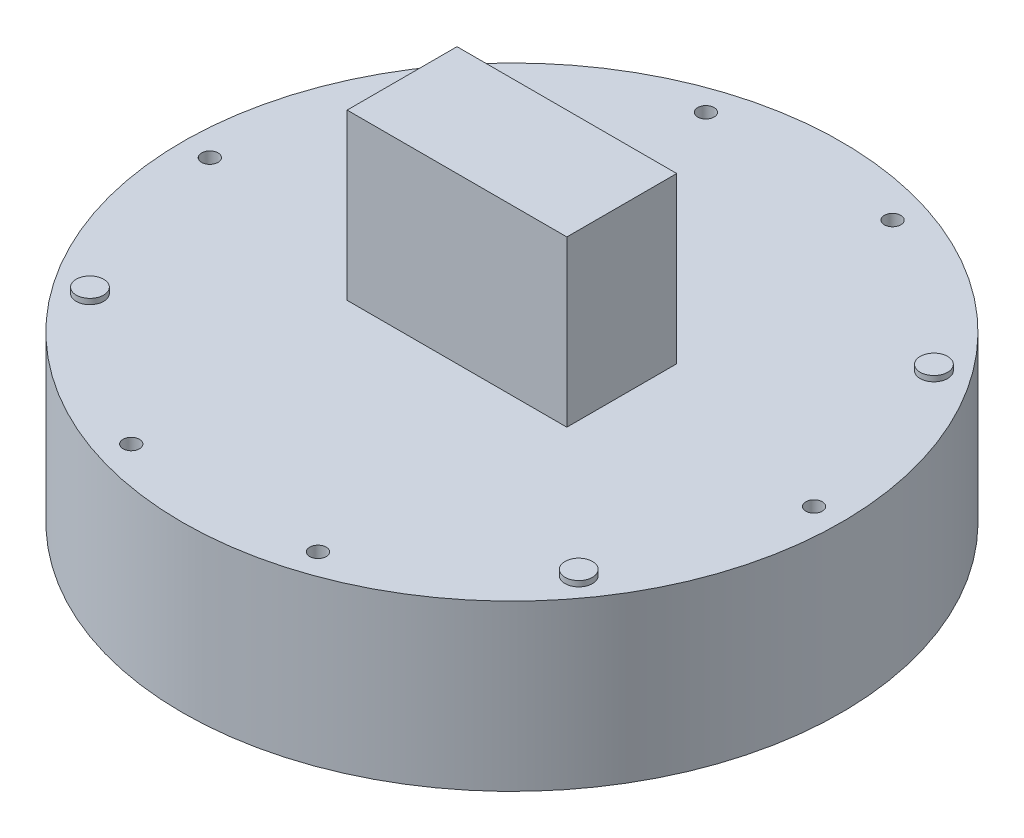
from build123d import *

# Parameters (mm, degrees)
SKETCH_1_R               = 60
EXTRUDE_1_DEPTH          = 30
SKETCH_2_R               = 1.5
CUT_EXTRUDE_1_DEPTH      = 5
PATTERN_CIRCULAR_1_COUNT = 10
SKETCH_3_W               = 40
SKETCH_3_H               = 20
EXTRUDE_2_DEPTH          = 30
SKETCH_5_R               = 2.5
EXTRUDE_4_DEPTH          = 1
SKETCH_7_R               = 2.5
CUT_EXTRUDE_2_DEPTH      = 1


with BuildPart() as part:
    # 草图1 → 凸台-拉伸1 (new body)
    with BuildSketch(Plane(origin=(0, 0, 0), x_dir=(1, 0, 0), z_dir=(0, 1, 0))):
        with Locations(Location((0, 0, 0), (0, 0, 270))):
            Circle(SKETCH_1_R)
    extrude(amount=EXTRUDE_1_DEPTH)

    # 草图2 → 切除-拉伸1 (cut)
    with BuildSketch(Plane(origin=(0, 30, 0), x_dir=(1, 0, 0), z_dir=(0, 1, 0))):
        with Locations(Location((55, 0, 0), (0, 0, 270))):
            Circle(SKETCH_2_R)
    cut_extrude_1 = extrude(amount=-CUT_EXTRUDE_1_DEPTH, mode=Mode.SUBTRACT)

    # 阵列(圆周)1: 切除-拉伸1 ×10 about axis
    pattern_circular_1_axis = Axis((0, 0, 0), (0, 1, 0))
    for i in range(1, PATTERN_CIRCULAR_1_COUNT):
        add(cut_extrude_1.rotate(pattern_circular_1_axis, i * 360 / PATTERN_CIRCULAR_1_COUNT), mode=Mode.SUBTRACT)

    # 草图3 → 凸台-拉伸2 (add)
    with BuildSketch(Plane(origin=(0, 30, 0), x_dir=(1, 0, 0), z_dir=(0, 1, 0))):
        Rectangle(SKETCH_3_W, SKETCH_3_H)
    extrude(amount=EXTRUDE_2_DEPTH)

    # 草图5 → 凸台-拉伸4 (add)
    with BuildSketch(Plane(origin=(0, 30, 0), x_dir=(1, 0, 0), z_dir=(0, 1, 0))):
        with Locations(Location((-44.495934691, 32.328188876, 0), (0, 0, 270))):
            Circle(SKETCH_5_R)
        with Locations(Location((44.495934691, -32.328188876, 0), (0, 0, 270))):
            Circle(SKETCH_5_R)
        with Locations(Location((44.495934691, 32.328188876, 0), (0, 0, 270))):
            Circle(SKETCH_5_R)
        with Locations(Location((-44.495934691, -32.328188876, 0), (0, 0, 270))):
            Circle(SKETCH_5_R)
    extrude(amount=EXTRUDE_4_DEPTH)

    # 草图7 → 切除-拉伸2 (cut)
    with BuildSketch(Plane.XZ):
        with Locations(Location((0, 0, 0), (0, 0, 270))):
            Circle(SKETCH_7_R)
    extrude(amount=-CUT_EXTRUDE_2_DEPTH, mode=Mode.SUBTRACT)


solid = part.part
